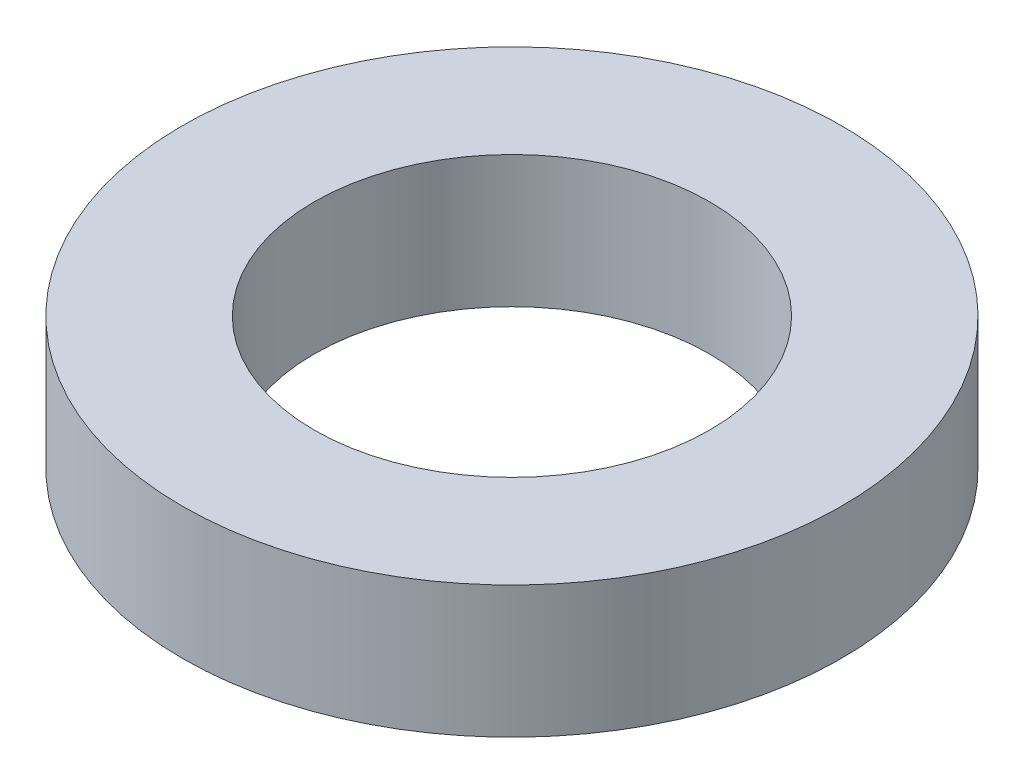
from build123d import *

# Parameters (mm, degrees)
SKETCH1_R           = 2.5
SKETCH1_R_2         = 1.5
BOSS_EXTRUDE1_DEPTH = 1


with BuildPart() as part:
    # Sketch1 → Boss-Extrude1 (new body)
    with BuildSketch(Plane(origin=(0, 0, 0), x_dir=(1, 0, 0), z_dir=(0, 1, 0))):
        with Locations(Location((0, 0, 0), (0, 0, 270))):
            Circle(SKETCH1_R)
        with Locations(Location((0, 0, 0), (0, 0, 270))):
            Circle(SKETCH1_R_2, mode=Mode.SUBTRACT)
    extrude(amount=BOSS_EXTRUDE1_DEPTH)


solid = part.part
